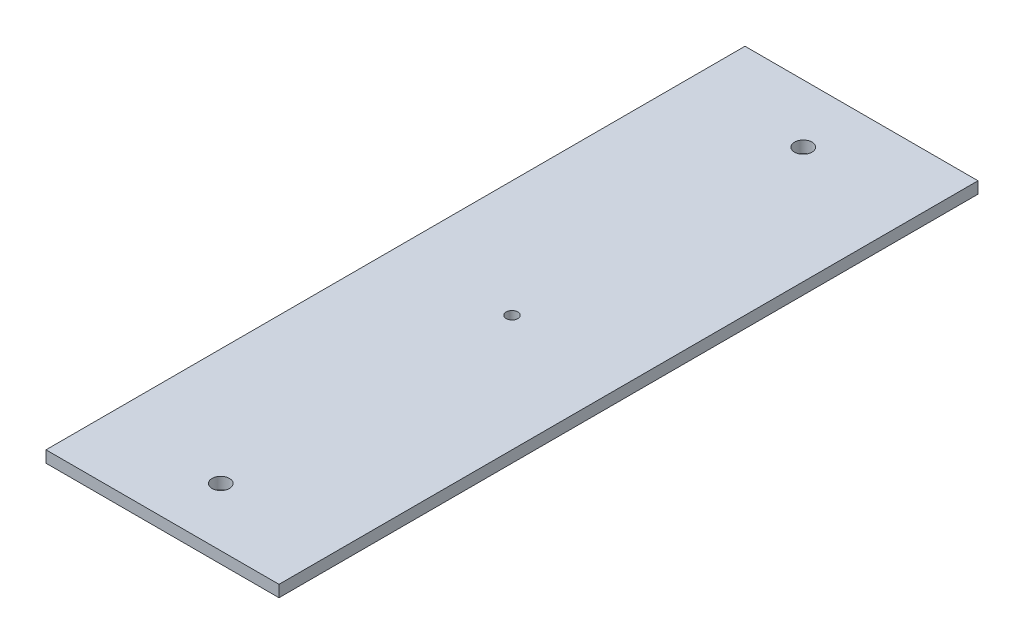
from build123d import *

# Parameters (mm, degrees)
SKETCH1_W           = 40
SKETCH1_H           = 120
SKETCH1_R           = 1.5
SKETCH1_R_2         = 1
BOSS_EXTRUDE1_DEPTH = 2


with BuildPart() as part:
    # Sketch1 → Boss-Extrude1 (new body)
    with BuildSketch(Plane(origin=(0, 0, 0), x_dir=(1, 0, 0), z_dir=(0, 1, 0))):
        with Locations((20, 60)):
            Rectangle(SKETCH1_W, SKETCH1_H)
        with Locations(Location((20, 10, 0), (0, 0, 270))):
            Circle(SKETCH1_R, mode=Mode.SUBTRACT)
        with Locations(Location((20, 110, 0), (0, 0, 270))):
            Circle(SKETCH1_R, mode=Mode.SUBTRACT)
        with Locations(Location((20, 60, 0), (0, 0, 270))):
            Circle(SKETCH1_R_2, mode=Mode.SUBTRACT)
    extrude(amount=BOSS_EXTRUDE1_DEPTH)


solid = part.part
